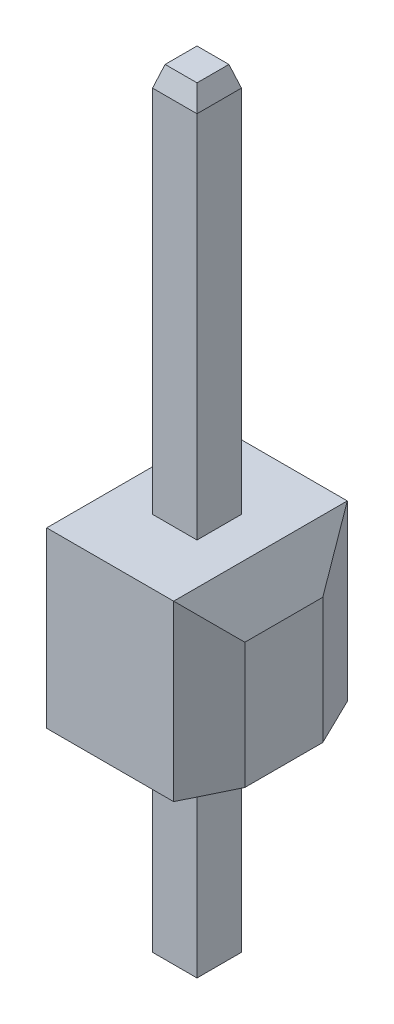
from build123d import *
from OCP.BRepFilletAPI import BRepFilletAPI_MakeChamfer

# Parameters (mm, degrees)
SKETCH1_W                = 2.54
SKETCH1_H                = 2.54
BOSS_EXTRUDE1_DEPTH      = 2.54
BOSS_EXTRUDE2_DEPTH      = 5.7
BOSS_EXTRUDE2_DEPTH_BACK = 5.64
SKETCH2_W                = 0.65
SKETCH2_H                = 0.65
CHAMFER1_SIZE            = 0.3
CHAMFER1_SIZE2           = 0.091719204
CHAMFER3_SIZE            = 0.7
CHAMFER3_SIZE2           = 0.341412812
CHAMFER4_SIZE            = 0.7
CHAMFER4_SIZE2           = 0.341412812


with BuildPart() as part:
    # Sketch1 → Boss-Extrude1 (new body)
    with BuildSketch(Plane(origin=(0, 0, 0), x_dir=(1, 0, 0), z_dir=(0, 1, 0))):
        Rectangle(SKETCH1_W, SKETCH1_H)
    extrude(amount=BOSS_EXTRUDE1_DEPTH)

    # Sketch2 → Boss-Extrude2 (add, two sides: drawn at the far end of the back side and taken through both)
    with BuildSketch(Plane(origin=(0, 2.54, 0), x_dir=(1, 0, 0), z_dir=(0, 1, 0)).offset(-BOSS_EXTRUDE2_DEPTH_BACK)):
        Rectangle(SKETCH2_W, SKETCH2_H)
    extrude(amount=BOSS_EXTRUDE2_DEPTH + BOSS_EXTRUDE2_DEPTH_BACK)

    # Chamfer1: one chamfer whose edges measure the first distance from different faces: ONE call of the kernel's chamfer builder (chamfer() names one face for all edges)
    chamfer1_edges_1 = [part.edges().sort_by_distance(p)[0] for p in [
        (-0.325, -3.1, 0),
        (0, -3.1, -0.325),
        (0.325, -3.1, 0),
        (0, -3.1, 0.325),
    ]]
    chamfer1_side_1 = [part.faces().sort_by_distance(p)[0] for p in [
        (0, -3.1, 0),
    ]]
    chamfer1_edges_2 = [part.edges().sort_by_distance(p)[0] for p in [
        (-0.325, 8.24, 0),
    ]]
    chamfer1_side_2 = [part.faces().sort_by_distance(p)[0] for p in [
        (-0.325, 5.39, 0),
    ]]
    chamfer1_edges_3 = [part.edges().sort_by_distance(p)[0] for p in [
        (0, 8.24, 0.325),
    ]]
    chamfer1_side_3 = [part.faces().sort_by_distance(p)[0] for p in [
        (0, 5.39, 0.325),
    ]]
    chamfer1_edges_4 = [part.edges().sort_by_distance(p)[0] for p in [
        (0.325, 8.24, 0),
    ]]
    chamfer1_side_4 = [part.faces().sort_by_distance(p)[0] for p in [
        (0.325, 5.39, 0),
    ]]
    chamfer1_edges_5 = [part.edges().sort_by_distance(p)[0] for p in [
        (0, 8.24, -0.325),
    ]]
    chamfer1_side_5 = [part.faces().sort_by_distance(p)[0] for p in [
        (0, 5.39, -0.325),
    ]]
    chamfer1 = BRepFilletAPI_MakeChamfer(part.part.solid().wrapped)
    for e in chamfer1_edges_1:
        chamfer1.Add(CHAMFER1_SIZE, CHAMFER1_SIZE2, e.wrapped, chamfer1_side_1[0].wrapped)  # the first distance lies on this face
    for e in chamfer1_edges_2:
        chamfer1.Add(CHAMFER1_SIZE, CHAMFER1_SIZE2, e.wrapped, chamfer1_side_2[0].wrapped)  # the first distance lies on this face
    for e in chamfer1_edges_3:
        chamfer1.Add(CHAMFER1_SIZE, CHAMFER1_SIZE2, e.wrapped, chamfer1_side_3[0].wrapped)  # the first distance lies on this face
    for e in chamfer1_edges_4:
        chamfer1.Add(CHAMFER1_SIZE, CHAMFER1_SIZE2, e.wrapped, chamfer1_side_4[0].wrapped)  # the first distance lies on this face
    for e in chamfer1_edges_5:
        chamfer1.Add(CHAMFER1_SIZE, CHAMFER1_SIZE2, e.wrapped, chamfer1_side_5[0].wrapped)  # the first distance lies on this face
    add(Compound.cast(chamfer1.Shape()), mode=Mode.REPLACE)

    # Chamfer3
    chamfer3_edges = [part.edges().sort_by_distance(p)[0] for p in [
        (1.27, 2.54, 0),
        (1.27, 1.27, 1.27),
        (1.27, 1.27, -1.27),
    ]]
    chamfer3_side = [part.faces().sort_by_distance(p)[0] for p in [
        (1.27, 1.27, 0),
    ]]
    chamfer(chamfer3_edges, length=CHAMFER3_SIZE, length2=CHAMFER3_SIZE2, reference=chamfer3_side[0])

    # Chamfer4
    chamfer4_edges = [part.edges().sort_by_distance(p)[0] for p in [
        (-1.27, 2.54, 0),
        (-1.27, 1.27, 1.27),
        (-1.27, 1.27, -1.27),
    ]]
    chamfer4_side = [part.faces().sort_by_distance(p)[0] for p in [
        (-1.27, 1.27, 0),
    ]]
    chamfer(chamfer4_edges, length=CHAMFER4_SIZE, length2=CHAMFER4_SIZE2, reference=chamfer4_side[0])


solid = part.part
